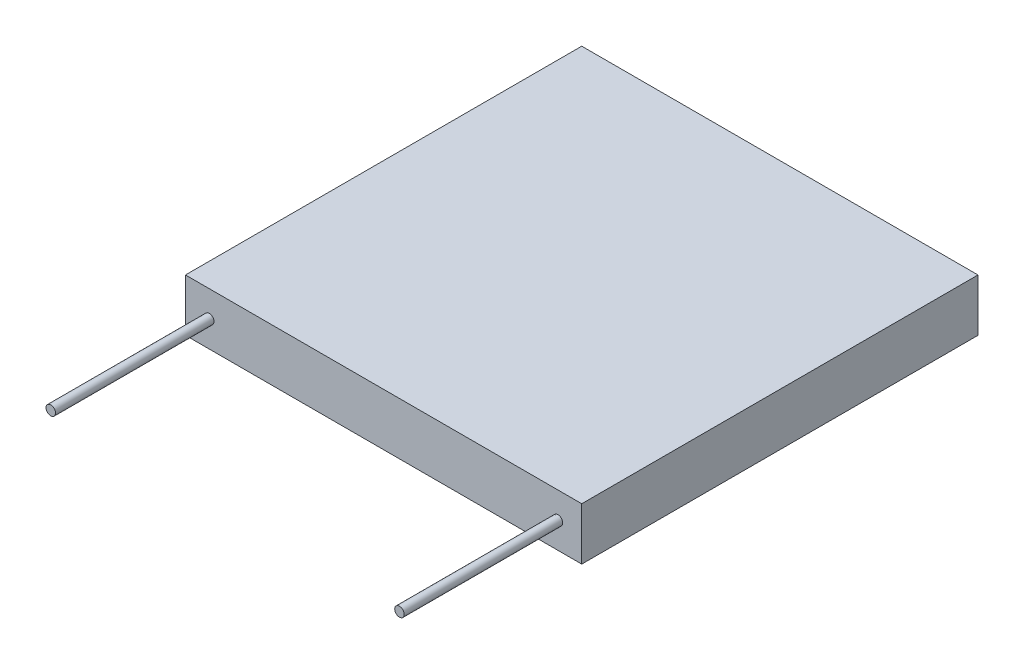
from build123d import *

# Parameters (mm, degrees)
EXTRUDE_1_DEPTH      = 1.65
EXTRUDE_1_DEPTH_BACK = 1.65
SKETCH_1_W           = 25
SKETCH_1_H           = 25
SKETCH_2_R           = 0.3
EXTRUDE_2_DEPTH      = 10


with BuildPart() as part:
    # 草图1 → 拉伸1 (new, two sides: drawn at the far end of the back side and taken through both)
    with BuildSketch(Plane(origin=(0, 0, 0), x_dir=(1, 0, 0), z_dir=(0, 1, 0)).offset(-EXTRUDE_1_DEPTH_BACK)):
        Rectangle(SKETCH_1_W, SKETCH_1_H)
    extrude(amount=EXTRUDE_1_DEPTH + EXTRUDE_1_DEPTH_BACK)

    # 草图2 → 拉伸2 (add)
    with BuildSketch(Plane.XY.offset(12.5)):
        with Locations((-11, 0)):
            Circle(SKETCH_2_R)
        with Locations((11, 0)):
            Circle(SKETCH_2_R)
    extrude(amount=EXTRUDE_2_DEPTH)


solid = part.part
